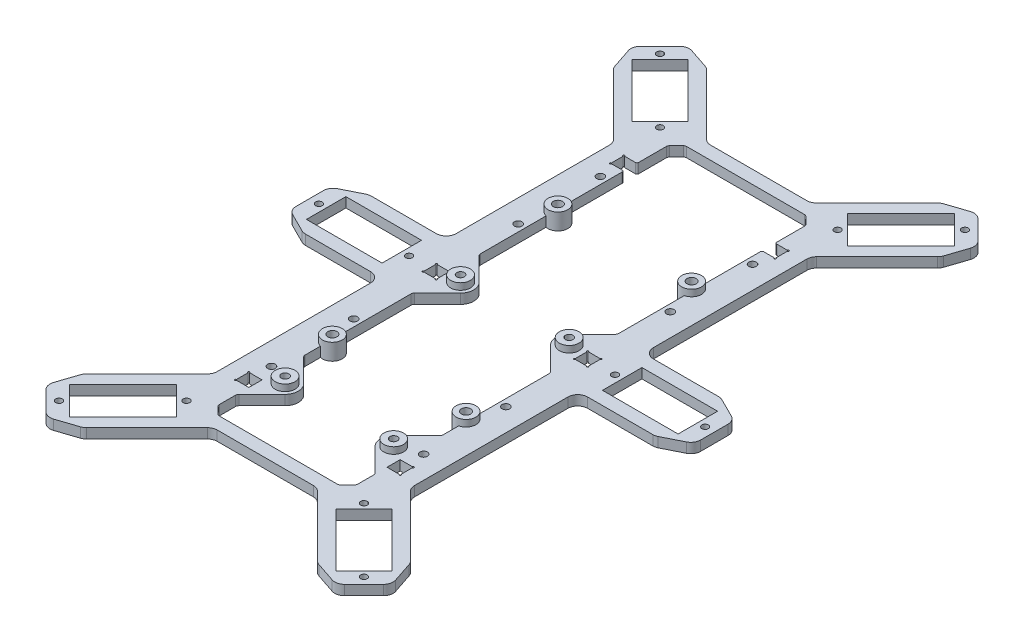
from build123d import *

# Parameters (mm, degrees)
EXTRUDE_1_DEPTH          = 1.5
SKETCH_2_R               = 1
SKETCH_2_W               = 23
SKETCH_2_H               = 12
EXTRUDE_2_DEPTH          = 3
MIRROR_2_COPY_1_SKETCH_R = 1
MIRROR_2_COPY_1_SKETCH_W = 23
MIRROR_2_COPY_1_SKETCH_H = 12
MIRROR_2_COPY_1_DEPTH    = 3
SKETCH_3_R               = 1.15
EXTRUDE_3_DEPTH          = 3
EXTRUDE_START            = 2
SKETCH_4_R               = 3
SKETCH_4_R_2             = 1.15
EXTRUDE_4_DEPTH          = 2
SKETCH_5_W               = 4
SKETCH_5_H               = 4
CUT_EXTRUDE_1_DEPTH      = 3
SKETCH_6_R               = 0.25
CUT_EXTRUDE_2_DEPTH      = 3
FILLET_1_R               = 0.5
FILLET_2_R               = 1
FILLET_3_R               = 3
FILLET_4_R               = 3
SKETCH_7_R               = 1.15
CUT_EXTRUDE_3_DEPTH      = 118.428811116
CUT_EXTRUDE_4_REACH      = 119.429
FILLET_5_R               = 3
FILLET_6_R               = 3
EXTRUDE_5_DEPTH          = 2
EXTRUDE_5_DEPTH_BACK     = 3
SKETCH_9_R               = 3
SKETCH_10_R              = 1.4
CUT_EXTRUDE_5_DEPTH      = 116.08414921


with BuildPart() as part:
    # 草图1 → 凸台-拉伸1 (new, symmetric)
    with BuildSketch(Plane(origin=(0, 0, 0), x_dir=(1, 0, 0), z_dir=(0, 1, 0))):
        Polygon((-20, 75), (-30, 65), (-30, -65), (-20, -75), (20, -75), (30, -65), (30, 65), (20, 75), align=None)
        Polygon((-18.343145751, 71), (-1.677763133, 71), (1.677763133, 71), (18.343145751, 71), (21, 68.343145751), (21, -68.343145751), (18.343145751, -71), (1.677763133, -71), (-1.677763133, -71), (-18.343145751, -71), (-21, -68.343145751), (-21, 68.343145751), align=None, mode=Mode.SUBTRACT)
    extrude(amount=EXTRUDE_1_DEPTH, both=True)

    # 草图2 → 凸台-拉伸2 (add, through all)
    # profile 1 of 2: a face of its own
    with BuildSketch(Plane(origin=(0, 1.5, 0), x_dir=(1, 0, 0), z_dir=(0, 1, 0))):
        with BuildLine():
            Line((28.5, 10), (60.5, 10))
            ThreePointArc((60.5, 10), (61.207106781, 9.707106781), (61.5, 9))
            Line((61.5, 9), (61.5, -9))
            ThreePointArc((61.5, -9), (61.207106781, -9.707106781), (60.5, -10))
            Line((60.5, -10), (28.5, -10))
            Line((28.5, -10), (28.5, 10))
        make_face()
        with Locations(Location((58.7, 0, 0), (0, 0, 270))):
            Circle(SKETCH_2_R, mode=Mode.SUBTRACT)
        with Locations(Location((31.3, 0, 0), (0, 0, 90))):
            Circle(SKETCH_2_R, mode=Mode.SUBTRACT)
        with Locations((45, 0)):
            Rectangle(SKETCH_2_W, SKETCH_2_H, mode=Mode.SUBTRACT)
    # profile 2 of 2: a face of its own
    with BuildSketch(Plane(origin=(0, 1.5, 0), x_dir=(1, 0, 0), z_dir=(0, 1, 0))):
        with BuildLine():
            Line((54.69848481, 85.556349186), (30, 60.857864376))
            Line((30, 60.857864376), (30, 65))
            Line((30, 65), (20, 75))
            Line((20, 75), (15.857864376, 75))
            Line((15.857864376, 75), (40.556349186, 99.69848481))
            ThreePointArc((40.556349186, 99.69848481), (41.263455967, 99.991378029), (41.970562748, 99.69848481))
            Line((41.970562748, 99.69848481), (54.69848481, 86.970562748))
            ThreePointArc((54.69848481, 86.970562748), (54.991378029, 86.263455967), (54.69848481, 85.556349186))
        make_face()
        with Locations(Location((46.354624792, 91.354624792, 0), (0, 0, 270))):
            Circle(SKETCH_2_R, mode=Mode.SUBTRACT)
        with Locations(Location((26.979898987, 71.979898987, 0), (0, 0, 90))):
            Circle(SKETCH_2_R, mode=Mode.SUBTRACT)
        Polygon((24.292893219, 77.778174593), (32.778174593, 69.292893219), (49.04163056, 85.556349186), (40.556349186, 94.04163056), align=None, mode=Mode.SUBTRACT)
    extrude_2 = extrude(amount=-EXTRUDE_2_DEPTH)

    # 镜向1: 凸台-拉伸2 across plane
    add(extrude_2.mirror(Plane.XY))

    # 镜向2: 凸台-拉伸2 across plane
    add(extrude_2.mirror(Plane(origin=(0, 0, 0), x_dir=(0, 0, 1), z_dir=(1, 0, 0))))

    # 镜向2 copy 1 sketch → 镜向2 copy 1 (add, through all)
    # profile 1 of 2: a face of its own
    with BuildSketch(Plane(origin=(0, 1.5, 0), x_dir=(-1, 0, 0), z_dir=(0, 1, 0))):
        with BuildLine():
            Line((28.5, 10), (60.5, 10))
            ThreePointArc((60.5, 10), (61.207106781, 9.707106781), (61.5, 9))
            Line((61.5, 9), (61.5, -9))
            ThreePointArc((61.5, -9), (61.207106781, -9.707106781), (60.5, -10))
            Line((60.5, -10), (28.5, -10))
            Line((28.5, -10), (28.5, 10))
        make_face()
        with Locations(Location((58.7, 0, 0), (0, 0, 270))):
            Circle(MIRROR_2_COPY_1_SKETCH_R, mode=Mode.SUBTRACT)
        with Locations(Location((31.3, 0, 0), (0, 0, 90))):
            Circle(MIRROR_2_COPY_1_SKETCH_R, mode=Mode.SUBTRACT)
        with Locations((45, 0)):
            Rectangle(MIRROR_2_COPY_1_SKETCH_W, MIRROR_2_COPY_1_SKETCH_H, mode=Mode.SUBTRACT)
    # profile 2 of 2: a face of its own
    with BuildSketch(Plane(origin=(0, 1.5, 0), x_dir=(-1, 0, 0), z_dir=(0, 1, 0))):
        with BuildLine():
            Line((54.69848481, 85.556349186), (30, 60.857864376))
            Line((30, 60.857864376), (30, 65))
            Line((30, 65), (20, 75))
            Line((20, 75), (15.857864376, 75))
            Line((15.857864376, 75), (40.556349186, 99.69848481))
            ThreePointArc((40.556349186, 99.69848481), (41.263455967, 99.991378029), (41.970562748, 99.69848481))
            Line((41.970562748, 99.69848481), (54.69848481, 86.970562748))
            ThreePointArc((54.69848481, 86.970562748), (54.991378029, 86.263455967), (54.69848481, 85.556349186))
        make_face()
        with Locations(Location((46.354624792, 91.354624792, 0), (0, 0, 270))):
            Circle(MIRROR_2_COPY_1_SKETCH_R, mode=Mode.SUBTRACT)
        with Locations(Location((26.979898987, 71.979898987, 0), (0, 0, 90))):
            Circle(MIRROR_2_COPY_1_SKETCH_R, mode=Mode.SUBTRACT)
        Polygon((24.292893219, 77.778174593), (32.778174593, 69.292893219), (49.04163056, 85.556349186), (40.556349186, 94.04163056), align=None, mode=Mode.SUBTRACT)
    extrude(amount=-MIRROR_2_COPY_1_DEPTH)

    # 草图3 → 凸台-拉伸3 (add)
    # profile 1 of 4: a face of its own
    with BuildSketch(Plane(origin=(0, 1.5, 0), x_dir=(1, 0, 0), z_dir=(0, 1, 0))):
        with BuildLine():
            Line((21, 11.014232964), (13.681605895, 3.69583886))
            ThreePointArc((13.681605895, 3.69583886), (12.51003302, 0.867411735), (13.681605895, -1.96101539))
            Line((13.681605895, -1.96101539), (21, -9.279409495))
            Line((21, -9.279409495), (21, 11.014232964))
        make_face()
        with Locations(Location((16.51003302, 0.867411735, 0), (0, 0, 270))):
            Circle(SKETCH_3_R, mode=Mode.SUBTRACT)
    # profile 2 of 4: a face of its own
    with BuildSketch(Plane(origin=(0, 1.5, 0), x_dir=(1, 0, 0), z_dir=(0, 1, 0))):
        with BuildLine():
            Line((21, -62.620989378), (21, -42.327346919))
            Line((21, -42.327346919), (13.681605895, -49.645741024))
            ThreePointArc((13.681605895, -49.645741024), (12.51003302, -52.474168148), (13.681605895, -55.302595273))
            Line((13.681605895, -55.302595273), (21, -62.620989378))
        make_face()
        with Locations(Location((16.51003302, -52.472694945, 0), (0, 0, 270))):
            Circle(SKETCH_3_R, mode=Mode.SUBTRACT)
    # profile 3 of 4: a face of its own
    with BuildSketch(Plane(origin=(0, 1.5, 0), x_dir=(1, 0, 0), z_dir=(0, 1, 0))):
        with BuildLine():
            Line((-21, 11.014232964), (-21, -9.279409495))
            Line((-21, -9.279409495), (-13.681605895, -1.96101539))
            ThreePointArc((-13.681605895, -1.96101539), (-12.51003302, 0.867411735), (-13.681605895, 3.69583886))
            Line((-13.681605895, 3.69583886), (-21, 11.014232964))
        make_face()
        with Locations(Location((-16.51003302, 0.867411735, 0), (0, 0, 270))):
            Circle(SKETCH_3_R, mode=Mode.SUBTRACT)
    # profile 4 of 4: a face of its own
    with BuildSketch(Plane(origin=(0, 1.5, 0), x_dir=(1, 0, 0), z_dir=(0, 1, 0))):
        with BuildLine():
            Line((-21, -62.620989378), (-13.681605895, -55.302595273))
            ThreePointArc((-13.681605895, -55.302595273), (-12.51003302, -52.474168148), (-13.681605895, -49.645741024))
            Line((-13.681605895, -49.645741024), (-21, -42.327346919))
            Line((-21, -42.327346919), (-21, -62.620989378))
        make_face()
        with Locations(Location((-16.51003302, -52.472694945, 0), (0, 0, 270))):
            Circle(SKETCH_3_R, mode=Mode.SUBTRACT)
    extrude(amount=-EXTRUDE_3_DEPTH)

    # 草图4 → 凸台-拉伸4 (add)
    # profile 1 of 4: a face of its own
    with BuildSketch(Plane(origin=(0, 1.5, 0), x_dir=(1, 0, 0), z_dir=(0, 1, 0)).offset(EXTRUDE_START)):
        with Locations(Location((16.51003302, -52.472694945, 0), (0, 0, 270))):
            Circle(SKETCH_4_R)
        with Locations(Location((16.51003302, -52.472694945, 0), (0, 0, 270))):
            Circle(SKETCH_4_R_2, mode=Mode.SUBTRACT)
    # profile 2 of 4: a face of its own
    with BuildSketch(Plane(origin=(0, 1.5, 0), x_dir=(1, 0, 0), z_dir=(0, 1, 0)).offset(EXTRUDE_START)):
        with Locations(Location((16.51003302, 0.867411735, 0), (0, 0, 270))):
            Circle(SKETCH_4_R)
        with Locations(Location((16.51003302, 0.867411735, 0), (0, 0, 270))):
            Circle(SKETCH_4_R_2, mode=Mode.SUBTRACT)
    # profile 3 of 4: a face of its own
    with BuildSketch(Plane(origin=(0, 1.5, 0), x_dir=(1, 0, 0), z_dir=(0, 1, 0)).offset(EXTRUDE_START)):
        with Locations(Location((-16.51003302, 0.867411735, 0), (0, 0, 90))):
            Circle(SKETCH_4_R)
        with Locations(Location((-16.51003302, 0.867411735, 0), (0, 0, 270))):
            Circle(SKETCH_4_R_2, mode=Mode.SUBTRACT)
    # profile 4 of 4: a face of its own
    with BuildSketch(Plane(origin=(0, 1.5, 0), x_dir=(1, 0, 0), z_dir=(0, 1, 0)).offset(EXTRUDE_START)):
        with Locations(Location((-16.51003302, -52.472694945, 0), (0, 0, 90))):
            Circle(SKETCH_4_R)
        with Locations(Location((-16.51003302, -52.472694945, 0), (0, 0, 270))):
            Circle(SKETCH_4_R_2, mode=Mode.SUBTRACT)
    extrude(amount=-EXTRUDE_4_DEPTH)

    # 草图5 → 切除-拉伸1 (cut)
    with BuildSketch(Plane(origin=(0, 1.5, 0), x_dir=(1, 0, 0), z_dir=(0, 1, 0))):
        with Locations((23, 0)):
            Rectangle(SKETCH_5_W, SKETCH_5_H)
        with Locations((23, -57)):
            Rectangle(SKETCH_5_W, SKETCH_5_H)
        with Locations((23, 57)):
            Rectangle(SKETCH_5_W, SKETCH_5_H)
        with Locations((-23, -57)):
            Rectangle(SKETCH_5_W, SKETCH_5_H)
        with Locations((-23, 0)):
            Rectangle(SKETCH_5_W, SKETCH_5_H)
        with Locations((-23, 57)):
            Rectangle(SKETCH_5_W, SKETCH_5_H)
    extrude(amount=-CUT_EXTRUDE_1_DEPTH, mode=Mode.SUBTRACT)

    # 草图6 → 切除-拉伸2 (cut)
    with BuildSketch(Plane(origin=(0, 1.5, 0), x_dir=(1, 0, 0), z_dir=(0, 1, 0))):
        with Locations((25, 59)):
            Circle(SKETCH_6_R)
        with Locations((25, 55)):
            Circle(SKETCH_6_R)
        with Locations((25, 2)):
            Circle(SKETCH_6_R)
        with Locations((21, 2)):
            Circle(SKETCH_6_R)
        with Locations((25, -55)):
            Circle(SKETCH_6_R)
        with Locations((25, -59)):
            Circle(SKETCH_6_R)
        with Locations((21, -2)):
            Circle(SKETCH_6_R)
        with Locations((25, -2)):
            Circle(SKETCH_6_R)
        with Locations((-25, -2)):
            Circle(SKETCH_6_R)
        with Locations((-21, -2)):
            Circle(SKETCH_6_R)
        with Locations((-25, -59)):
            Circle(SKETCH_6_R)
        with Locations((-25, -55)):
            Circle(SKETCH_6_R)
        with Locations((-21, 2)):
            Circle(SKETCH_6_R)
        with Locations((-25, 2)):
            Circle(SKETCH_6_R)
        with Locations((-25, 55)):
            Circle(SKETCH_6_R)
        with Locations((-25, 59)):
            Circle(SKETCH_6_R)
    extrude(amount=-CUT_EXTRUDE_2_DEPTH, mode=Mode.SUBTRACT)

    # 圆角1
    fillet_1_edges = [part.edges().sort_by_distance(p)[0] for p in [
        (21, 0, -55),
        (21, 0, -59),
        (-21, 0, -59),
        (-21, 0, -55),
    ]]
    fillet(fillet_1_edges, radius=FILLET_1_R)

    # 圆角2
    fillet_2_edges = [part.edges().sort_by_distance(p)[0] for p in [
        (-18.343145751, 0, -71),
        (-21, 0, -68.343145751),
        (-21, 0, 68.343145751),
        (-18.343145751, 0, 71),
        (18.343145751, 0, 71),
        (21, 0, 68.343145751),
        (21, 0, -68.343145751),
        (18.343145751, 0, -71),
        (-21, 0, 9.279409495),
        (-21, 0, -11.014232964),
        (21, 0, -11.014232964),
        (21, 0, 9.279409495),
        (21, 0, 42.327346919),
        (21, 0, 62.620989378),
        (-21, 0, 62.620989378),
        (-21, 0, 42.327346919),
    ]]
    fillet(fillet_2_edges, radius=FILLET_2_R)

    # 圆角3
    fillet_3_edges = [part.edges().sort_by_distance(p)[0] for p in [
        (15.857864376, 0, -75),
        (30, 0, -60.857864376),
        (-30, 0, -10),
        (-15.857864376, 0, -75),
        (-30, 0, -60.857864376),
        (30, 0, -10),
    ]]
    fillet(fillet_3_edges, radius=FILLET_3_R)

    # 圆角4
    fillet_4_edges = [part.edges().sort_by_distance(p)[0] for p in [
        (15.857864376, 0, 75),
        (30, 0, 60.857864376),
        (-30, 0, 10),
        (-15.857864376, 0, 75),
        (-30, 0, 60.857864376),
        (30, 0, 10),
    ]]
    fillet(fillet_4_edges, radius=FILLET_4_R)

    # 草图7 → 切除-拉伸3 (cut, through all)
    with BuildSketch(Plane(origin=(0, 1.5, 0), x_dir=(1, 0, 0), z_dir=(0, 1, 0))):
        with Locations(Location((23.125, 50, 0), (0, 0, 270))):
            Circle(SKETCH_7_R)
        with Locations(Location((23.125, 25, 0), (0, 0, 270))):
            Circle(SKETCH_7_R)
        with Locations(Location((23.125, -50, 0), (0, 0, 90))):
            Circle(SKETCH_7_R)
        with Locations(Location((23.125, -25, 0), (0, 0, 90))):
            Circle(SKETCH_7_R)
        with Locations(Location((-23.125, 50, 0), (0, 0, 90))):
            Circle(SKETCH_7_R)
        with Locations(Location((-23.125, 25, 0), (0, 0, 90))):
            Circle(SKETCH_7_R)
        with Locations(Location((-23.125, -25, 0), (0, 0, 270))):
            Circle(SKETCH_7_R)
        with Locations(Location((-23.125, -50, 0), (0, 0, 270))):
            Circle(SKETCH_7_R)
    extrude(amount=-CUT_EXTRUDE_3_DEPTH, mode=Mode.SUBTRACT)

    # 草图8 → 切除-拉伸4 (cut, up to next)
    with BuildSketch(Plane(origin=(0, 1.5, 0), x_dir=(1, 0, 0), z_dir=(0, 1, 0)), mode=Mode.PRIVATE) as cut_extrude_4_sk1:
        with BuildLine():
            Line((53.5, 10), (61.5, 6))
            Line((61.5, 6), (61.5, 9))
            ThreePointArc((61.5, 9), (61.207106781, 9.707106781), (60.5, 10))
            Line((60.5, 10), (53.5, 10))
        make_face()
    cut_extrude_4_tool1 = extrude(cut_extrude_4_sk1.sketch, amount=-CUT_EXTRUDE_4_REACH, mode=Mode.PRIVATE) & part.part
    # 草图8 → 切除-拉伸4 (cut, up to next)
    with BuildSketch(Plane(origin=(0, 1.5, 0), x_dir=(1, 0, 0), z_dir=(0, 1, 0)), mode=Mode.PRIVATE) as cut_extrude_4_sk2:
        with BuildLine():
            Line((61.5, -9), (61.5, -6))
            Line((61.5, -6), (53.5, -10))
            Line((53.5, -10), (60.5, -10))
            ThreePointArc((60.5, -10), (61.207106781, -9.707106781), (61.5, -9))
        make_face()
    cut_extrude_4_tool2 = extrude(cut_extrude_4_sk2.sketch, amount=-CUT_EXTRUDE_4_REACH, mode=Mode.PRIVATE) & part.part
    # 草图8 → 切除-拉伸4 (cut, up to next)
    with BuildSketch(Plane(origin=(0, 1.5, 0), x_dir=(1, 0, 0), z_dir=(0, 1, 0)), mode=Mode.PRIVATE) as cut_extrude_4_sk3:
        with BuildLine():
            Line((52.577164466, -89.091883092), (49.748737342, -80.606601718))
            Line((49.748737342, -80.606601718), (54.69848481, -85.556349186))
            ThreePointArc((54.69848481, -85.556349186), (54.991378029, -86.263455967), (54.69848481, -86.970562748))
            Line((54.69848481, -86.970562748), (52.577164466, -89.091883092))
        make_face()
    cut_extrude_4_tool3 = extrude(cut_extrude_4_sk3.sketch, amount=-CUT_EXTRUDE_4_REACH, mode=Mode.PRIVATE) & part.part
    # 草图8 → 切除-拉伸4 (cut, up to next)
    with BuildSketch(Plane(origin=(0, 1.5, 0), x_dir=(1, 0, 0), z_dir=(0, 1, 0)), mode=Mode.PRIVATE) as cut_extrude_4_sk4:
        with BuildLine():
            Line((44.091883092, -97.577164466), (35.606601718, -94.748737342))
            Line((35.606601718, -94.748737342), (40.556349186, -99.69848481))
            ThreePointArc((40.556349186, -99.69848481), (41.263455967, -99.991378029), (41.970562748, -99.69848481))
            Line((41.970562748, -99.69848481), (44.091883092, -97.577164466))
        make_face()
    cut_extrude_4_tool4 = extrude(cut_extrude_4_sk4.sketch, amount=-CUT_EXTRUDE_4_REACH, mode=Mode.PRIVATE) & part.part
    # 草图8 → 切除-拉伸4 (cut, up to next)
    with BuildSketch(Plane(origin=(0, 1.5, 0), x_dir=(1, 0, 0), z_dir=(0, 1, 0)), mode=Mode.PRIVATE) as cut_extrude_4_sk5:
        with BuildLine():
            Line((40.556349186, 99.69848481), (35.606601718, 94.748737342))
            Line((35.606601718, 94.748737342), (44.091883092, 97.577164466))
            Line((44.091883092, 97.577164466), (41.970562748, 99.69848481))
            ThreePointArc((41.970562748, 99.69848481), (41.263455967, 99.991378029), (40.556349186, 99.69848481))
        make_face()
    cut_extrude_4_tool5 = extrude(cut_extrude_4_sk5.sketch, amount=-CUT_EXTRUDE_4_REACH, mode=Mode.PRIVATE) & part.part
    # 草图8 → 切除-拉伸4 (cut, up to next)
    with BuildSketch(Plane(origin=(0, 1.5, 0), x_dir=(1, 0, 0), z_dir=(0, 1, 0)), mode=Mode.PRIVATE) as cut_extrude_4_sk6:
        with BuildLine():
            Line((49.748737342, 80.606601718), (54.69848481, 85.556349186))
            ThreePointArc((54.69848481, 85.556349186), (54.991378029, 86.263455967), (54.69848481, 86.970562748))
            Line((54.69848481, 86.970562748), (52.577164466, 89.091883092))
            Line((52.577164466, 89.091883092), (49.748737342, 80.606601718))
        make_face()
    cut_extrude_4_tool6 = extrude(cut_extrude_4_sk6.sketch, amount=-CUT_EXTRUDE_4_REACH, mode=Mode.PRIVATE) & part.part
    # 草图8 → 切除-拉伸4 (cut, up to next)
    with BuildSketch(Plane(origin=(0, 1.5, 0), x_dir=(1, 0, 0), z_dir=(0, 1, 0)), mode=Mode.PRIVATE) as cut_extrude_4_sk7:
        with BuildLine():
            Line((-54.69848481, 86.970562748), (-52.577164466, 89.091883092))
            Line((-52.577164466, 89.091883092), (-49.748737342, 80.606601718))
            Line((-49.748737342, 80.606601718), (-54.69848481, 85.556349186))
            ThreePointArc((-54.69848481, 85.556349186), (-54.991378029, 86.263455967), (-54.69848481, 86.970562748))
        make_face()
    cut_extrude_4_tool7 = extrude(cut_extrude_4_sk7.sketch, amount=-CUT_EXTRUDE_4_REACH, mode=Mode.PRIVATE) & part.part
    # 草图8 → 切除-拉伸4 (cut, up to next)
    with BuildSketch(Plane(origin=(0, 1.5, 0), x_dir=(1, 0, 0), z_dir=(0, 1, 0)), mode=Mode.PRIVATE) as cut_extrude_4_sk8:
        with BuildLine():
            Line((-44.091883092, 97.577164466), (-41.970562748, 99.69848481))
            ThreePointArc((-41.970562748, 99.69848481), (-41.263455967, 99.991378029), (-40.556349186, 99.69848481))
            Line((-40.556349186, 99.69848481), (-35.606601718, 94.748737342))
            Line((-35.606601718, 94.748737342), (-44.091883092, 97.577164466))
        make_face()
    cut_extrude_4_tool8 = extrude(cut_extrude_4_sk8.sketch, amount=-CUT_EXTRUDE_4_REACH, mode=Mode.PRIVATE) & part.part
    # 草图8 → 切除-拉伸4 (cut, up to next)
    with BuildSketch(Plane(origin=(0, 1.5, 0), x_dir=(1, 0, 0), z_dir=(0, 1, 0)), mode=Mode.PRIVATE) as cut_extrude_4_sk9:
        with BuildLine():
            Line((-44.091883092, -97.577164466), (-41.970562748, -99.69848481))
            ThreePointArc((-41.970562748, -99.69848481), (-41.263455967, -99.991378029), (-40.556349186, -99.69848481))
            Line((-40.556349186, -99.69848481), (-35.606601718, -94.748737342))
            Line((-35.606601718, -94.748737342), (-44.091883092, -97.577164466))
        make_face()
    cut_extrude_4_tool9 = extrude(cut_extrude_4_sk9.sketch, amount=-CUT_EXTRUDE_4_REACH, mode=Mode.PRIVATE) & part.part
    # 草图8 → 切除-拉伸4 (cut, up to next)
    with BuildSketch(Plane(origin=(0, 1.5, 0), x_dir=(1, 0, 0), z_dir=(0, 1, 0)), mode=Mode.PRIVATE) as cut_extrude_4_sk10:
        with BuildLine():
            Line((-54.69848481, -86.970562748), (-52.577164466, -89.091883092))
            Line((-52.577164466, -89.091883092), (-49.748737342, -80.606601718))
            Line((-49.748737342, -80.606601718), (-54.69848481, -85.556349186))
            ThreePointArc((-54.69848481, -85.556349186), (-54.991378029, -86.263455967), (-54.69848481, -86.970562748))
        make_face()
    cut_extrude_4_tool10 = extrude(cut_extrude_4_sk10.sketch, amount=-CUT_EXTRUDE_4_REACH, mode=Mode.PRIVATE) & part.part
    # 草图8 → 切除-拉伸4 (cut, up to next)
    with BuildSketch(Plane(origin=(0, 1.5, 0), x_dir=(1, 0, 0), z_dir=(0, 1, 0)), mode=Mode.PRIVATE) as cut_extrude_4_sk11:
        with BuildLine():
            Line((-61.5, 6), (-61.5, 9))
            ThreePointArc((-61.5, 9), (-61.207106781, 9.707106781), (-60.5, 10))
            Line((-60.5, 10), (-53.5, 10))
            Line((-53.5, 10), (-61.5, 6))
        make_face()
    cut_extrude_4_tool11 = extrude(cut_extrude_4_sk11.sketch, amount=-CUT_EXTRUDE_4_REACH, mode=Mode.PRIVATE) & part.part
    # 草图8 → 切除-拉伸4 (cut, up to next)
    with BuildSketch(Plane(origin=(0, 1.5, 0), x_dir=(1, 0, 0), z_dir=(0, 1, 0)), mode=Mode.PRIVATE) as cut_extrude_4_sk12:
        with BuildLine():
            Line((-53.5, -10), (-60.5, -10))
            ThreePointArc((-60.5, -10), (-61.207106781, -9.707106781), (-61.5, -9))
            Line((-61.5, -9), (-61.5, -6))
            Line((-61.5, -6), (-53.5, -10))
        make_face()
    cut_extrude_4_tool12 = extrude(cut_extrude_4_sk12.sketch, amount=-CUT_EXTRUDE_4_REACH, mode=Mode.PRIVATE) & part.part
    add(cut_extrude_4_tool1.solids().sort_by_distance((58.800117, 1.5, -8.651577))[0], mode=Mode.SUBTRACT)
    add(cut_extrude_4_tool2.solids().sort_by_distance((58.800117, 1.5, 8.651577))[0], mode=Mode.SUBTRACT)
    add(cut_extrude_4_tool3.solids().sort_by_distance((52.543007, 1.5, 85.307829))[0], mode=Mode.SUBTRACT)
    add(cut_extrude_4_tool4.solids().sort_by_distance((40.307829, 1.5, 97.543007))[0], mode=Mode.SUBTRACT)
    add(cut_extrude_4_tool5.solids().sort_by_distance((40.307829, 1.5, -97.543007))[0], mode=Mode.SUBTRACT)
    add(cut_extrude_4_tool6.solids().sort_by_distance((52.543007, 1.5, -85.307829))[0], mode=Mode.SUBTRACT)
    add(cut_extrude_4_tool7.solids().sort_by_distance((-52.543007, 1.5, -85.307829))[0], mode=Mode.SUBTRACT)
    add(cut_extrude_4_tool8.solids().sort_by_distance((-40.307829, 1.5, -97.543007))[0], mode=Mode.SUBTRACT)
    add(cut_extrude_4_tool9.solids().sort_by_distance((-40.307829, 1.5, 97.543007))[0], mode=Mode.SUBTRACT)
    add(cut_extrude_4_tool10.solids().sort_by_distance((-52.543007, 1.5, 85.307829))[0], mode=Mode.SUBTRACT)
    add(cut_extrude_4_tool11.solids().sort_by_distance((-58.800117, 1.5, -8.651577))[0], mode=Mode.SUBTRACT)
    add(cut_extrude_4_tool12.solids().sort_by_distance((-58.800117, 1.5, 8.651577))[0], mode=Mode.SUBTRACT)

    # 圆角5
    fillet_5_edges = [part.edges().sort_by_distance(p)[0] for p in [
        (49.748737342, 0, -80.606601718),
        (52.577164466, 0, -89.091883092),
        (44.091883092, 0, 97.577164466),
        (35.606601718, 0, 94.748737342),
        (44.091883092, 0, -97.577164466),
        (35.606601718, 0, -94.748737342),
        (52.577164466, 0, 89.091883092),
        (49.748737342, 0, 80.606601718),
        (53.5, 0, 10),
        (61.5, 0, 6),
        (53.5, 0, -10),
        (61.5, 0, -6),
    ]]
    fillet(fillet_5_edges, radius=FILLET_5_R)

    # 圆角6
    fillet_6_edges = [part.edges().sort_by_distance(p)[0] for p in [
        (-52.577164466, 0, -89.091883092),
        (-49.748737342, 0, -80.606601718),
        (-35.606601718, 0, -94.748737342),
        (-44.091883092, 0, -97.577164466),
        (-49.748737342, 0, 80.606601718),
        (-52.577164466, 0, 89.091883092),
        (-44.091883092, 0, 97.577164466),
        (-35.606601718, 0, 94.748737342),
        (-61.5, 0, 6),
        (-53.5, 0, 10),
        (-53.5, 0, -10),
        (-61.5, 0, -6),
    ]]
    fillet(fillet_6_edges, radius=FILLET_6_R)

    # 草图9 → 凸台-拉伸5 (add, two sides: drawn at the far end of the back side and taken through both)
    with BuildSketch(Plane(origin=(0, 1.5, 0), x_dir=(1, 0, 0), z_dir=(0, 1, 0)).offset(-EXTRUDE_5_DEPTH_BACK)):
        with Locations(Location((-20.32, -34.29, 0), (0, 0, 270))):
            Circle(SKETCH_9_R)
        with Locations(Location((20.32, -34.29, 0), (0, 0, 270))):
            Circle(SKETCH_9_R)
        with Locations(Location((20.32, 34.29, 0), (0, 0, 270))):
            Circle(SKETCH_9_R)
        with Locations(Location((-20.32, 34.29, 0), (0, 0, 270))):
            Circle(SKETCH_9_R)
    extrude(amount=EXTRUDE_5_DEPTH + EXTRUDE_5_DEPTH_BACK)

    # 草图10 → 切除-拉伸5 (cut, through all)
    with BuildSketch(Plane(origin=(0, 3.5, 0), x_dir=(1, 0, 0), z_dir=(0, 1, 0))):
        with Locations(Location((20.32, 34.29, 0), (0, 0, 270))):
            Circle(SKETCH_10_R)
        with Locations(Location((-20.32, 34.29, 0), (0, 0, 270))):
            Circle(SKETCH_10_R)
        with Locations(Location((20.32, -34.29, 0), (0, 0, 270))):
            Circle(SKETCH_10_R)
        with Locations(Location((-20.32, -34.29, 0), (0, 0, 270))):
            Circle(SKETCH_10_R)
    extrude(amount=-CUT_EXTRUDE_5_DEPTH, mode=Mode.SUBTRACT)


solid = part.part
